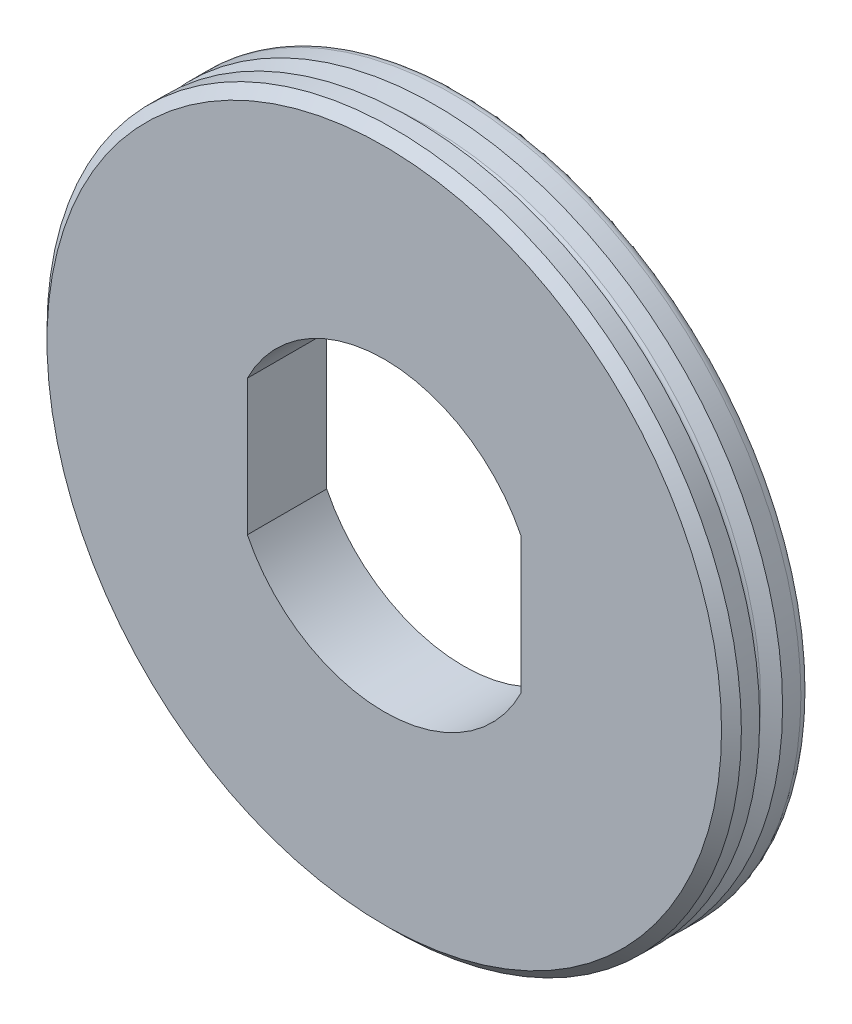
from build123d import *

# Parameters (mm, degrees)
SKETCH_1_R      = 17.5
EXTRUDE_2_DEPTH = 2
CHAMFER_1_SIZE  = 0.5
FILLET_2_R      = 0.5
FILLET_3_R      = 0.2


with BuildPart() as part:
    # Эскиз1 → Бобышка-Вытянуть2 (new, symmetric)
    with BuildSketch(Plane.XY):
        Circle(SKETCH_1_R)
        with BuildLine():
            Line((6.9, 3.417601498), (6.9, -3.417601498))
            ThreePointArc((6.9, -3.417601498), (0, -7.7), (-6.9, -3.417601498))
            Line((-6.9, -3.417601498), (-6.9, 3.417601498))
            ThreePointArc((-6.9, 3.417601498), (0, 7.7), (6.9, 3.417601498))
        make_face(mode=Mode.SUBTRACT)
    extrude(amount=EXTRUDE_2_DEPTH, both=True)

    # Эскиз2 → Вырез-Повернуть1 (revolve, cut)
    with BuildSketch(Plane(origin=(0, 0, 0), x_dir=(0, 0, -1), z_dir=(1, 0, 0)), mode=Mode.PRIVATE) as cut_revolve_1_sk:
        Polygon((-0.577350269, 17.5), (0.577350269, 17.5), (0, 16.5), align=None)
    revolve(cut_revolve_1_sk.sketch.rotate(Axis((0, 0, 3.24866267), (0, 0, -1)), 90), axis=Axis((0, 0, 3.24866267), (0, 0, -1)), mode=Mode.SUBTRACT)

    # Фаска1
    chamfer_1_edges = [part.edges().sort_by_distance(p)[0] for p in [
        (-17.5, 0, 2),
    ]]
    chamfer(chamfer_1_edges, length=CHAMFER_1_SIZE)

    # Скругление2
    fillet_2_edges = [part.edges().sort_by_distance(p)[0] for p in [
        (-17.5, 0, -2),
    ]]
    fillet(fillet_2_edges, radius=FILLET_2_R)

    # Скругление3
    fillet_3_edges = [part.edges().sort_by_distance(p)[0] for p in [
        (-16.5, 0, 0),
    ]]
    fillet(fillet_3_edges, radius=FILLET_3_R)


solid = part.part
